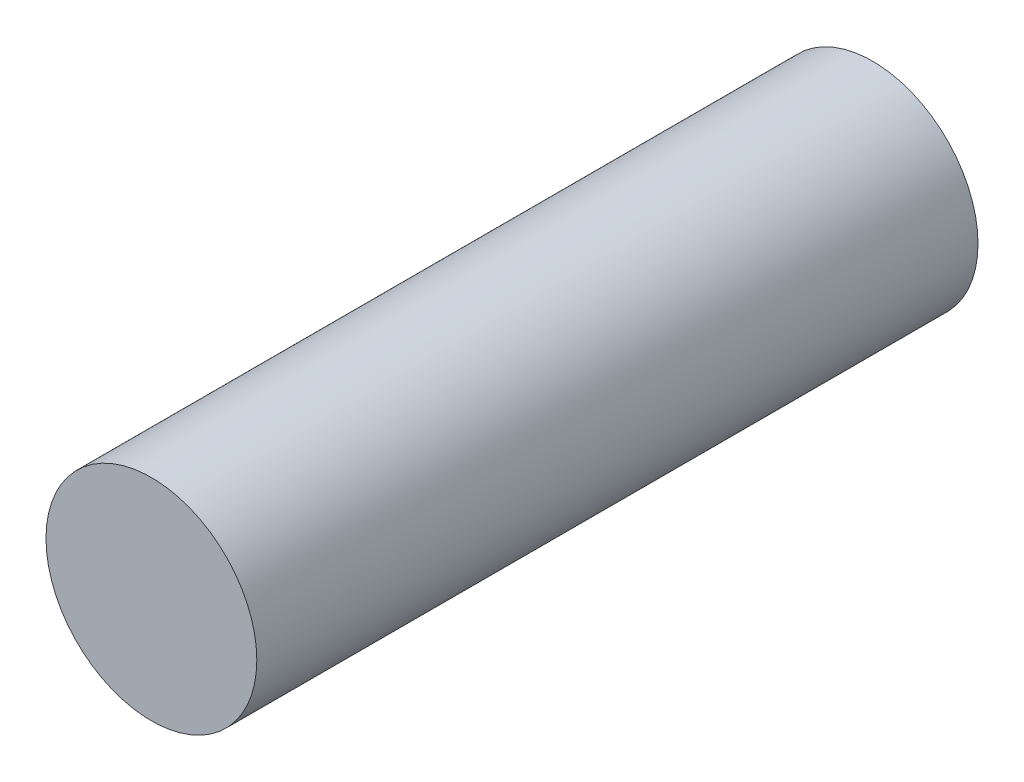
from build123d import *

# Parameters (mm, degrees)
SKETCH1_R           = 9.5
BOSS_EXTRUDE1_DEPTH = 65


with BuildPart() as part:
    # Sketch1 → Boss-Extrude1 (new body)
    with BuildSketch(Plane.XY):
        Circle(SKETCH1_R)
    extrude(amount=BOSS_EXTRUDE1_DEPTH)


solid = part.part
